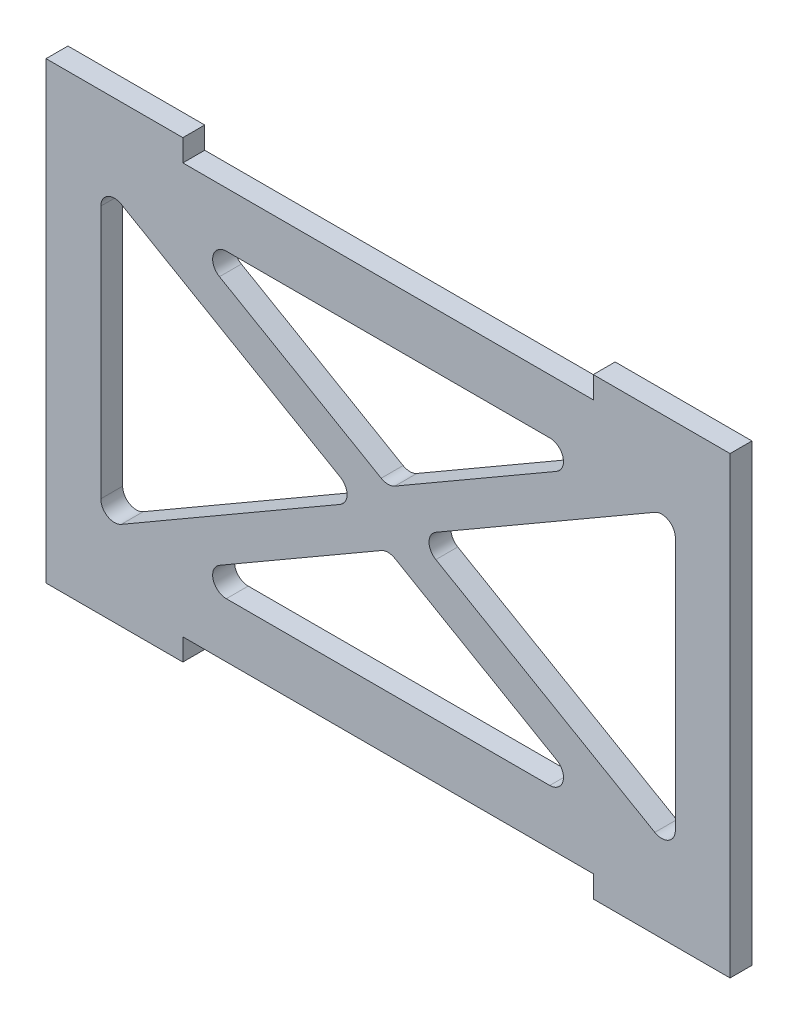
from build123d import *

# Parameters (mm, degrees)
SKETCH1_W           = 50
SKETCH1_H           = 30
BOSS_EXTRUDE1_DEPTH = 1.6
SKETCH2_W           = 10
SKETCH2_H           = 1.6
BOSS_EXTRUDE2_DEPTH = 1.6
CUT_EXTRUDE1_DEPTH  = 60.170262802
FILLET1_R           = 1


with BuildPart() as part:
    # Sketch1 → Boss-Extrude1 (new body)
    with BuildSketch(Plane.XY):
        with Locations((25, 15)):
            Rectangle(SKETCH1_W, SKETCH1_H)
    extrude(amount=BOSS_EXTRUDE1_DEPTH)

    # Sketch2 → Boss-Extrude2 (add)
    with BuildSketch(Plane.XY.offset(1.6)):
        with Locations((5, 30.8)):
            Rectangle(SKETCH2_W, SKETCH2_H)
        with Locations((45, 30.8)):
            Rectangle(SKETCH2_W, SKETCH2_H)
        with Locations((45, -0.8)):
            Rectangle(SKETCH2_W, SKETCH2_H)
        with Locations((5, -0.8)):
            Rectangle(SKETCH2_W, SKETCH2_H)
    extrude(amount=-BOSS_EXTRUDE2_DEPTH)

    # Sketch3 → Cut-Extrude1 (cut, through all)
    with BuildSketch(Plane.XY.offset(1.6)):
        Polygon((4, 26), (4, 4), (23, 15), align=None)
        Polygon((9.454545455, 26), (40.545454545, 26), (25, 17), align=None)
        Polygon((25, 13), (9.454545455, 4), (40.545454545, 4), align=None)
        Polygon((27, 15), (46, 26), (46, 4), align=None)
    extrude(amount=-CUT_EXTRUDE1_DEPTH, mode=Mode.SUBTRACT)

    # Fillet1
    fillet1_edges = [part.edges().sort_by_distance(p)[0] for p in [
        (46, 4, 0.8),
        (27, 15, 0.8),
        (46, 26, 0.8),
        (25, 17, 0.8),
        (9.454545455, 26, 0.8),
        (40.545454545, 26, 0.8),
        (25, 13, 0.8),
        (40.545454545, 4, 0.8),
        (9.454545455, 4, 0.8),
        (4, 26, 0.8),
        (23, 15, 0.8),
        (4, 4, 0.8),
    ]]
    fillet(fillet1_edges, radius=FILLET1_R)


solid = part.part
